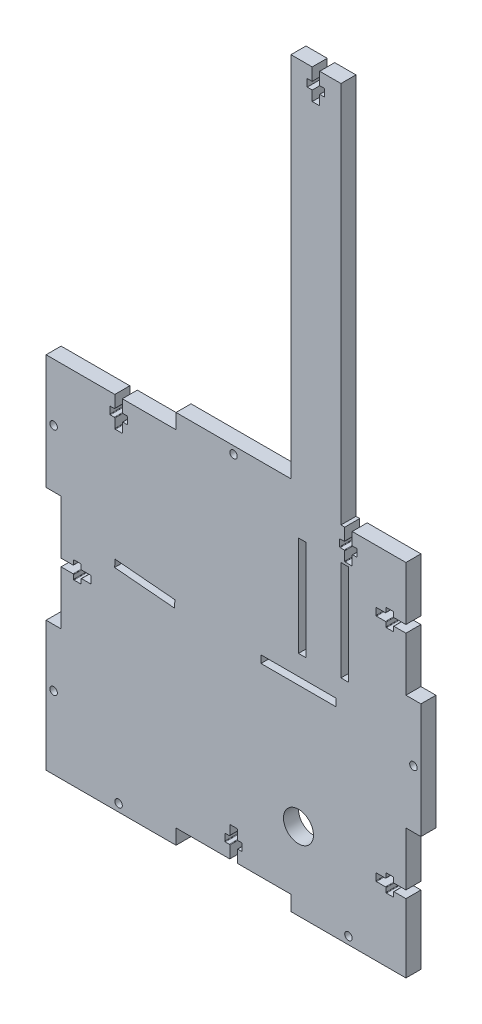
from build123d import *

# Parameters (mm, degrees)
BOX_SIDE_DEPTH       = 6
SKETCH2_R            = 1.5
SCREW_CUT_OUTS_DEPTH = 107.235587258
BEARING_HOLE_R       = 6
SHAFT_HOLE_DEPTH     = 107.235587258
SKETCH4_W            = 30
SKETCH4_H            = 3
SKETCH4_W_2          = 3
SKETCH4_H_2          = 40
GROOVES_DEPTH        = 6
SKETCH5_W            = 20
SKETCH5_H            = 6
BOSS_EXTRUDE1_DEPTH  = 153
SKETCH6_W            = 3
SKETCH6_H            = 4
CUT_EXTRUDE1_DEPTH   = 235.403498267
CUT_EXTRUDE2_DEPTH   = 235.403498267


with BuildPart() as part:
    # Sketch1 → Box Side (new body)
    with BuildSketch(Plane.XY):
        Polygon((-69, 69), (-23, 69), (-23, 75), (23, 75), (23, 69), (69, 69), (69, 23), (75, 23), (75, -23), (69, -23), (69, -69), (69, -75), (23, -75), (23, -69), (-23, -69), (-23, -75), (-69, -75), (-75, -75), (-75, -69), (-75, -23), (-69, -23), (-69, 23), (-75, 23), (-75, 69), align=None)
    extrude(amount=BOX_SIDE_DEPTH)

    # Sketch2 → Screw Cut-outs (cut, through all)
    with BuildSketch(Plane.XY.offset(6)):
        with Locations((0, 72)):
            Circle(SKETCH2_R)
        with Locations(Location((72, 0, 0), (0, 0, 180))):
            Circle(SKETCH2_R)
        with Locations((-46, -72)):
            Circle(SKETCH2_R)
        with Locations(Location((46, -72, 0), (0, 0, 180))):
            Circle(SKETCH2_R)
        with Locations((-72, 46)):
            Circle(SKETCH2_R)
        with Locations(Location((-72, -46, 0), (0, 0, 180))):
            Circle(SKETCH2_R)
        with BuildLine():
            Line((-44.5, 69), (-44.5, 64.2))
            ThreePointArc((-44.5, 64.2), (-44.441421356, 64.058578644), (-44.3, 64))
            Line((-44.3, 64), (-42.7, 64))
            ThreePointArc((-42.7, 64), (-42.558578644, 63.941421356), (-42.5, 63.8))
            Line((-42.5, 63.8), (-42.5, 61.2))
            ThreePointArc((-42.5, 61.2), (-42.558578644, 61.058578644), (-42.7, 61))
            Line((-42.7, 61), (-44.3, 61))
            ThreePointArc((-44.3, 61), (-44.441421356, 60.941421356), (-44.5, 60.8))
            Line((-44.5, 60.8), (-44.5, 57.2))
            ThreePointArc((-44.5, 57.2), (-44.558578644, 57.058578644), (-44.7, 57))
            Line((-44.7, 57), (-47.3, 57))
            ThreePointArc((-47.3, 57), (-47.441421356, 57.058578644), (-47.5, 57.2))
            Line((-47.5, 57.2), (-47.5, 60.8))
            ThreePointArc((-47.5, 60.8), (-47.558578644, 60.941421356), (-47.7, 61))
            Line((-47.7, 61), (-49.3, 61))
            ThreePointArc((-49.3, 61), (-49.441421356, 61.058578644), (-49.5, 61.2))
            Line((-49.5, 61.2), (-49.5, 63.8))
            ThreePointArc((-49.5, 63.8), (-49.441421356, 63.941421356), (-49.3, 64))
            Line((-49.3, 64), (-47.7, 64))
            ThreePointArc((-47.7, 64), (-47.558578644, 64.058578644), (-47.5, 64.2))
            Line((-47.5, 64.2), (-47.5, 69))
            Line((-47.5, 69), (-44.5, 69))
        make_face()
        with BuildLine():
            Line((47.5, 69), (47.5, 64.2))
            ThreePointArc((47.5, 64.2), (47.558578644, 64.058578644), (47.7, 64))
            Line((47.7, 64), (49.3, 64))
            ThreePointArc((49.3, 64), (49.441421356, 63.941421356), (49.5, 63.8))
            Line((49.5, 63.8), (49.5, 61.2))
            ThreePointArc((49.5, 61.2), (49.441421356, 61.058578644), (49.3, 61))
            Line((49.3, 61), (47.7, 61))
            ThreePointArc((47.7, 61), (47.558578644, 60.941421356), (47.5, 60.8))
            Line((47.5, 60.8), (47.5, 57.2))
            ThreePointArc((47.5, 57.2), (47.441421356, 57.058578644), (47.3, 57))
            Line((47.3, 57), (44.7, 57))
            ThreePointArc((44.7, 57), (44.558578644, 57.058578644), (44.5, 57.2))
            Line((44.5, 57.2), (44.5, 60.8))
            ThreePointArc((44.5, 60.8), (44.441421356, 60.941421356), (44.3, 61))
            Line((44.3, 61), (42.7, 61))
            ThreePointArc((42.7, 61), (42.558578644, 61.058578644), (42.5, 61.2))
            Line((42.5, 61.2), (42.5, 63.8))
            ThreePointArc((42.5, 63.8), (42.558578644, 63.941421356), (42.7, 64))
            Line((42.7, 64), (44.3, 64))
            ThreePointArc((44.3, 64), (44.441421356, 64.058578644), (44.5, 64.2))
            Line((44.5, 64.2), (44.5, 69))
            Line((44.5, 69), (47.5, 69))
        make_face()
        with BuildLine():
            Line((69, 44.5), (64.2, 44.5))
            ThreePointArc((64.2, 44.5), (64.058578644, 44.441421356), (64, 44.3))
            Line((64, 44.3), (64, 42.7))
            ThreePointArc((64, 42.7), (63.941421356, 42.558578644), (63.8, 42.5))
            Line((63.8, 42.5), (61.2, 42.5))
            ThreePointArc((61.2, 42.5), (61.058578644, 42.558578644), (61, 42.7))
            Line((61, 42.7), (61, 44.3))
            ThreePointArc((61, 44.3), (60.941421356, 44.441421356), (60.8, 44.5))
            Line((60.8, 44.5), (57.2, 44.5))
            ThreePointArc((57.2, 44.5), (57.058578644, 44.558578644), (57, 44.7))
            Line((57, 44.7), (57, 47.3))
            ThreePointArc((57, 47.3), (57.058578644, 47.441421356), (57.2, 47.5))
            Line((57.2, 47.5), (60.8, 47.5))
            ThreePointArc((60.8, 47.5), (60.941421356, 47.558578644), (61, 47.7))
            Line((61, 47.7), (61, 49.3))
            ThreePointArc((61, 49.3), (61.058578644, 49.441421356), (61.2, 49.5))
            Line((61.2, 49.5), (63.8, 49.5))
            ThreePointArc((63.8, 49.5), (63.941421356, 49.441421356), (64, 49.3))
            Line((64, 49.3), (64, 47.7))
            ThreePointArc((64, 47.7), (64.058578644, 47.558578644), (64.2, 47.5))
            Line((64.2, 47.5), (69, 47.5))
            Line((69, 47.5), (69, 44.5))
        make_face()
        with BuildLine():
            Line((69, -47.5), (64.2, -47.5))
            ThreePointArc((64.2, -47.5), (64.058578644, -47.558578644), (64, -47.7))
            Line((64, -47.7), (64, -49.3))
            ThreePointArc((64, -49.3), (63.941421356, -49.441421356), (63.8, -49.5))
            Line((63.8, -49.5), (61.2, -49.5))
            ThreePointArc((61.2, -49.5), (61.058578644, -49.441421356), (61, -49.3))
            Line((61, -49.3), (61, -47.7))
            ThreePointArc((61, -47.7), (60.941421356, -47.558578644), (60.8, -47.5))
            Line((60.8, -47.5), (57.2, -47.5))
            ThreePointArc((57.2, -47.5), (57.058578644, -47.441421356), (57, -47.3))
            Line((57, -47.3), (57, -44.7))
            ThreePointArc((57, -44.7), (57.058578644, -44.558578644), (57.2, -44.5))
            Line((57.2, -44.5), (60.8, -44.5))
            ThreePointArc((60.8, -44.5), (60.941421356, -44.441421356), (61, -44.3))
            Line((61, -44.3), (61, -42.7))
            ThreePointArc((61, -42.7), (61.058578644, -42.558578644), (61.2, -42.5))
            Line((61.2, -42.5), (63.8, -42.5))
            ThreePointArc((63.8, -42.5), (63.941421356, -42.558578644), (64, -42.7))
            Line((64, -42.7), (64, -44.3))
            ThreePointArc((64, -44.3), (64.058578644, -44.441421356), (64.2, -44.5))
            Line((64.2, -44.5), (69, -44.5))
            Line((69, -44.5), (69, -47.5))
        make_face()
        with BuildLine():
            Line((-1.5, -69), (1.5, -69))
            Line((1.5, -69), (1.5, -64.2))
            ThreePointArc((1.5, -64.2), (1.558578644, -64.058578644), (1.7, -64))
            Line((1.7, -64), (3.3, -64))
            ThreePointArc((3.3, -64), (3.441421356, -63.941421356), (3.5, -63.8))
            Line((3.5, -63.8), (3.5, -61.2))
            ThreePointArc((3.5, -61.2), (3.441421356, -61.058578644), (3.3, -61))
            Line((3.3, -61), (1.7, -61))
            ThreePointArc((1.7, -61), (1.558578644, -60.941421356), (1.5, -60.8))
            Line((1.5, -60.8), (1.5, -57.2))
            ThreePointArc((1.5, -57.2), (1.441421356, -57.058578644), (1.3, -57))
            Line((1.3, -57), (-1.3, -57))
            ThreePointArc((-1.3, -57), (-1.441421356, -57.058578644), (-1.5, -57.2))
            Line((-1.5, -57.2), (-1.5, -60.8))
            ThreePointArc((-1.5, -60.8), (-1.558578644, -60.941421356), (-1.7, -61))
            Line((-1.7, -61), (-3.3, -61))
            ThreePointArc((-3.3, -61), (-3.441421356, -61.058578644), (-3.5, -61.2))
            Line((-3.5, -61.2), (-3.5, -63.8))
            ThreePointArc((-3.5, -63.8), (-3.441421356, -63.941421356), (-3.3, -64))
            Line((-3.3, -64), (-1.7, -64))
            ThreePointArc((-1.7, -64), (-1.558578644, -64.058578644), (-1.5, -64.2))
            Line((-1.5, -64.2), (-1.5, -69))
        make_face()
        with BuildLine():
            Line((-69, -1.5), (-64.2, -1.5))
            ThreePointArc((-64.2, -1.5), (-64.058578644, -1.558578644), (-64, -1.7))
            Line((-64, -1.7), (-64, -3.3))
            ThreePointArc((-64, -3.3), (-63.941421356, -3.441421356), (-63.8, -3.5))
            Line((-63.8, -3.5), (-61.2, -3.5))
            ThreePointArc((-61.2, -3.5), (-61.058578644, -3.441421356), (-61, -3.3))
            Line((-61, -3.3), (-61, -1.7))
            ThreePointArc((-61, -1.7), (-60.941421356, -1.558578644), (-60.8, -1.5))
            Line((-60.8, -1.5), (-57.2, -1.5))
            ThreePointArc((-57.2, -1.5), (-57.058578644, -1.441421356), (-57, -1.3))
            Line((-57, -1.3), (-57, 1.3))
            ThreePointArc((-57, 1.3), (-57.058578644, 1.441421356), (-57.2, 1.5))
            Line((-57.2, 1.5), (-60.8, 1.5))
            ThreePointArc((-60.8, 1.5), (-60.941421356, 1.558578644), (-61, 1.7))
            Line((-61, 1.7), (-61, 3.3))
            ThreePointArc((-61, 3.3), (-61.058578644, 3.441421356), (-61.2, 3.5))
            Line((-61.2, 3.5), (-63.8, 3.5))
            ThreePointArc((-63.8, 3.5), (-63.941421356, 3.441421356), (-64, 3.3))
            Line((-64, 3.3), (-64, 1.7))
            ThreePointArc((-64, 1.7), (-64.058578644, 1.558578644), (-64.2, 1.5))
            Line((-64.2, 1.5), (-69, 1.5))
            Line((-69, 1.5), (-69, -1.5))
        make_face()
    extrude(amount=-SCREW_CUT_OUTS_DEPTH, mode=Mode.SUBTRACT)

    # Bearing Hole → Shaft Hole (cut, through all)
    with BuildSketch(Plane.XY.offset(6)):
        with Locations((26, -44)):
            Circle(BEARING_HOLE_R)
    extrude(amount=-SHAFT_HOLE_DEPTH, mode=Mode.SUBTRACT)

    # Sketch4 → Grooves (cut)
    with BuildSketch(Plane(origin=(0, 0, 0), x_dir=(-1, 0, 0), z_dir=(0, 0, -1))):
        with Locations((-26, 6.5)):
            Rectangle(SKETCH4_W, SKETCH4_H)
        with Locations((-44.5, 36)):
            Rectangle(SKETCH4_W_2, SKETCH4_H_2)
        with Locations((-27.5, 36)):
            Rectangle(SKETCH4_W_2, SKETCH4_H_2)
    extrude(amount=-GROOVES_DEPTH, mode=Mode.SUBTRACT)

    # Sketch5 → Boss-Extrude1 (add)
    with BuildSketch(Plane(origin=(0, 69, 0), x_dir=(1, 0, 0), z_dir=(0, 1, 0))):
        with Locations((33, -3)):
            Rectangle(SKETCH5_W, SKETCH5_H)
    extrude(amount=BOSS_EXTRUDE1_DEPTH)

    # Sketch6 → Cut-Extrude1 (cut, through all)
    with BuildSketch(Plane(origin=(0, 0, 0), x_dir=(-1, 0, 0), z_dir=(0, 0, -1))):
        Polygon((-31.5, 222), (-34.5, 222), (-34.5, 217), (-36.5, 217), (-36.5, 214), (-34.5, 214), (-31.5, 214), (-29.5, 214), (-29.5, 217), (-31.5, 217), align=None)
        with Locations((-33, 212)):
            Rectangle(SKETCH6_W, SKETCH6_H)
    extrude(amount=-CUT_EXTRUDE1_DEPTH, mode=Mode.SUBTRACT)

    # Sketch7 → Cut-Extrude2 (cut, through all)
    with BuildSketch(Plane(origin=(0, 0, 0), x_dir=(-1, 0, 0), z_dir=(0, 0, -1))):
        Polygon((23.418186009, 9.873848469), (23.679653237, 6.885264375), (47.588325991, 8.977002201), (47.326858763, 11.965586295), align=None)
    extrude(amount=-CUT_EXTRUDE2_DEPTH, mode=Mode.SUBTRACT)


solid = part.part
